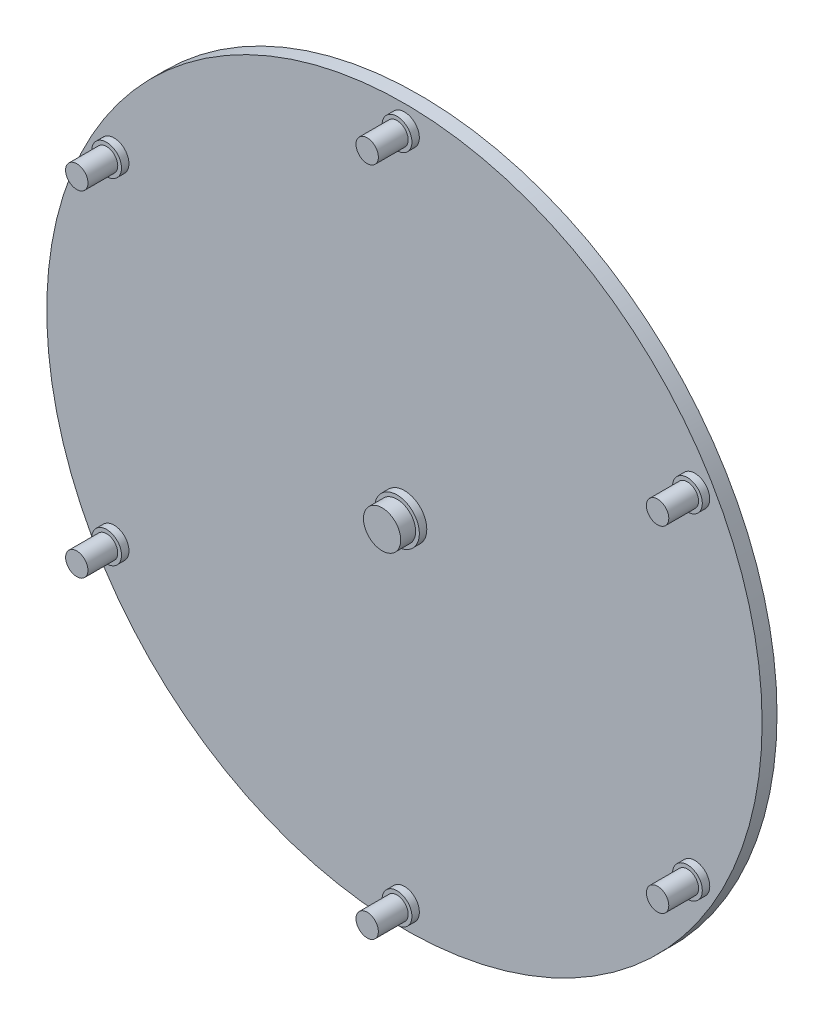
from build123d import *

# Parameters (mm, degrees)
SKETCH_1_R               = 96
EXTRUDE_1_DEPTH          = 4
SKETCH_2_R               = 5
EXTRUDE_2_DEPTH          = 6
SKETCH_3_R               = 3
EXTRUDE_3_DEPTH          = 10
PATTERN_CIRCULAR_1_COUNT = 6
SKETCH_4_R               = 6
EXTRUDE_4_DEPTH          = 2
SKETCH_5_R               = 4
EXTRUDE_5_DEPTH          = 2
PATTERN_CIRCULAR_2_COUNT = 6
SKETCH_6_R               = 7
EXTRUDE_6_DEPTH          = 8
EXTRUDE_START            = 15
SKETCH_7_R               = 5
SKETCH_7_R_2             = 3
EXTRUDE_1_2_DEPTH        = 15


with BuildPart() as part:
    # 草图1 → Extrude 1 (new body)
    with BuildSketch(Plane.XY):
        Circle(SKETCH_1_R)
    extrude(amount=EXTRUDE_1_DEPTH)

    # 草图2 → 凸台-拉伸2 (add)
    with BuildSketch(Plane.XY.offset(4)):
        Circle(SKETCH_2_R)
    extrude(amount=EXTRUDE_2_DEPTH)

    # 草图3 → 凸台-拉伸3 (add)
    with BuildSketch(Plane.XY.offset(4)):
        with Locations((0, 90)):
            Circle(SKETCH_3_R)
    extrude_3 = extrude(amount=EXTRUDE_3_DEPTH)

    # 阵列(圆周)1: 凸台-拉伸3 ×6 about axis
    pattern_circular_1_axis = Axis((0, 0, 0), (0, 0, 1))
    for i in range(1, PATTERN_CIRCULAR_1_COUNT):
        add(extrude_3.rotate(pattern_circular_1_axis, i * 360 / PATTERN_CIRCULAR_1_COUNT))

    # 草图4 → 凸台-拉伸4 (add)
    with BuildSketch(Plane.XY.offset(4)):
        Circle(SKETCH_4_R)
    extrude(amount=EXTRUDE_4_DEPTH)

    # 草图5 → 凸台-拉伸5 (add)
    with BuildSketch(Plane.XY.offset(4)):
        with Locations((0, 90)):
            Circle(SKETCH_5_R)
    extrude_5 = extrude(amount=EXTRUDE_5_DEPTH)

    # 阵列(圆周)2: 凸台-拉伸5 ×6 about axis
    pattern_circular_2_axis = Axis((0, 0, 0), (0, 0, 1))
    for i in range(1, PATTERN_CIRCULAR_2_COUNT):
        add(extrude_5.rotate(pattern_circular_2_axis, i * 360 / PATTERN_CIRCULAR_2_COUNT))

    # 草图6 → 凸台-拉伸6 (add)
    with BuildSketch(Plane(origin=(0, 0, 0), x_dir=(-1, 0, 0), z_dir=(0, 0, -1))):
        with Locations(Location((0, 0, 0), (0, 0, 180))):
            Circle(SKETCH_6_R)
    extrude(amount=EXTRUDE_6_DEPTH)

    # 草图7 → Extrude 1 2 (add)
    with BuildSketch(Plane(origin=(0, 0, -8), x_dir=(-1, 0, 0), z_dir=(0, 0, -1)).offset(EXTRUDE_START)):
        Circle(SKETCH_7_R)
        Circle(SKETCH_7_R_2, mode=Mode.SUBTRACT)
    extrude(amount=-EXTRUDE_1_2_DEPTH)


solid = part.part
